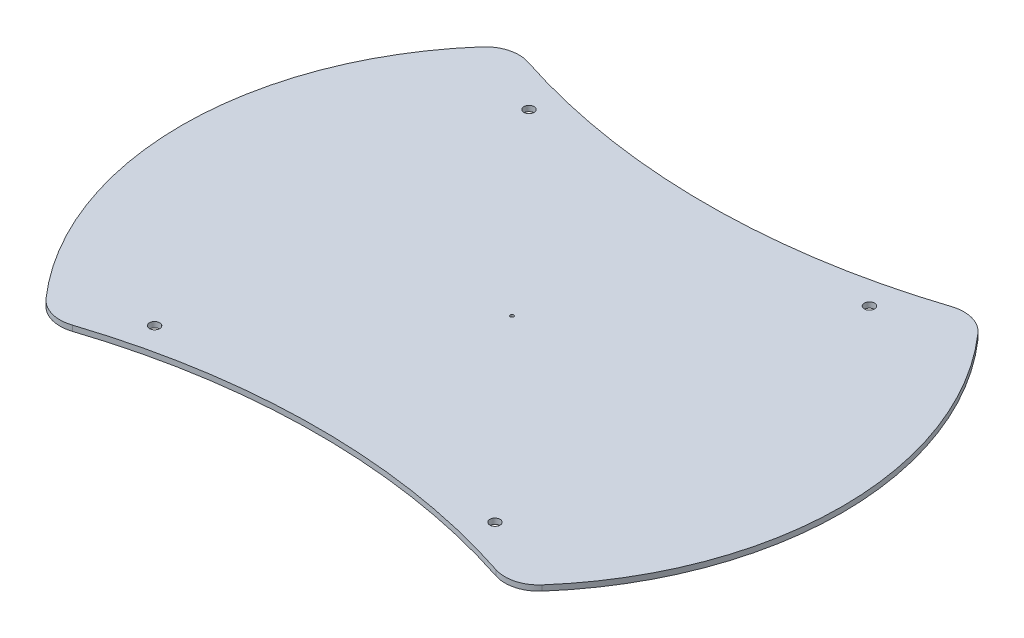
from build123d import *

# Parameters (mm, degrees)
ESBO_O1_R                 = 0.5
RESSALTO_EXTRUS_O1_DEPTH  = 1.6
FILETE1_R                 = 10
ESBO_O2_R                 = 1.5
CORTE_EXTRUS_O1_DEPTH     = 119.14439181
ESPELHAR2_COPY_1_SKETCH_R = 1.5
ESPELHAR2_COPY_1_DEPTH    = 119.14439181


with BuildPart() as part:
    # Esboço1 → Ressalto-extrusão1 (new body)
    with BuildSketch(Plane(origin=(0, 0, 0), x_dir=(1, 0, 0), z_dir=(0, 1, 0))):
        with BuildLine():
            ThreePointArc((68.191990862, -68.984435798), (89.508723356, -37.378983978), (97, 0))
            ThreePointArc((97, 0), (89.508723356, 37.378983978), (68.191990862, 68.984435798))
            ThreePointArc((68.191990862, 68.984435798), (0, 57), (-68.191990862, 68.984435798))
            ThreePointArc((-68.191990862, 68.984435798), (-97, 0), (-68.191990862, -68.984435798))
            ThreePointArc((-68.191990862, -68.984435798), (0, -57), (68.191990862, -68.984435798))
        make_face()
        with Locations(Location((0, 0, 0), (0, 0, 270))):
            Circle(ESBO_O1_R, mode=Mode.SUBTRACT)
    extrude(amount=RESSALTO_EXTRUS_O1_DEPTH)

    # Filete1
    filete1_edges = [part.edges().sort_by_distance(p)[0] for p in [
        (-68.191990862, 0.8, -68.984435798),
        (68.191990862, 0.8, -68.984435798),
        (68.191990862, 0.8, 68.984435798),
        (-68.191990862, 0.8, 68.984435798),
    ]]
    fillet(filete1_edges, radius=FILETE1_R)

    # Esboço2 → Corte-extrusão1 (cut, through all)
    with BuildSketch(Plane(origin=(0, 1.6, 0), x_dir=(1, 0, 0), z_dir=(0, 1, 0))):
        with Locations(Location((-50, 55, 0), (0, 0, 270))):
            Circle(ESBO_O2_R)
    corte_extrus_o1 = extrude(amount=-CORTE_EXTRUS_O1_DEPTH, mode=Mode.SUBTRACT)

    # Espelhar1: Corte-extrusão1 across plane
    add(corte_extrus_o1.mirror(Plane(origin=(0, 0, 0), x_dir=(0, 0, 1), z_dir=(1, 0, 0))), mode=Mode.SUBTRACT)

    # Espelhar2: Corte-extrusão1 across plane
    add(corte_extrus_o1.mirror(Plane.XY), mode=Mode.SUBTRACT)

    # Espelhar2 copy 1 sketch → Espelhar2 copy 1 (cut, through all)
    with BuildSketch(Plane(origin=(0, 1.6, 0), x_dir=(-1, 0, 0), z_dir=(0, 1, 0))):
        with Locations(Location((-50, 55, 0), (0, 0, 270))):
            Circle(ESPELHAR2_COPY_1_SKETCH_R)
    extrude(amount=-ESPELHAR2_COPY_1_DEPTH, mode=Mode.SUBTRACT)


solid = part.part
